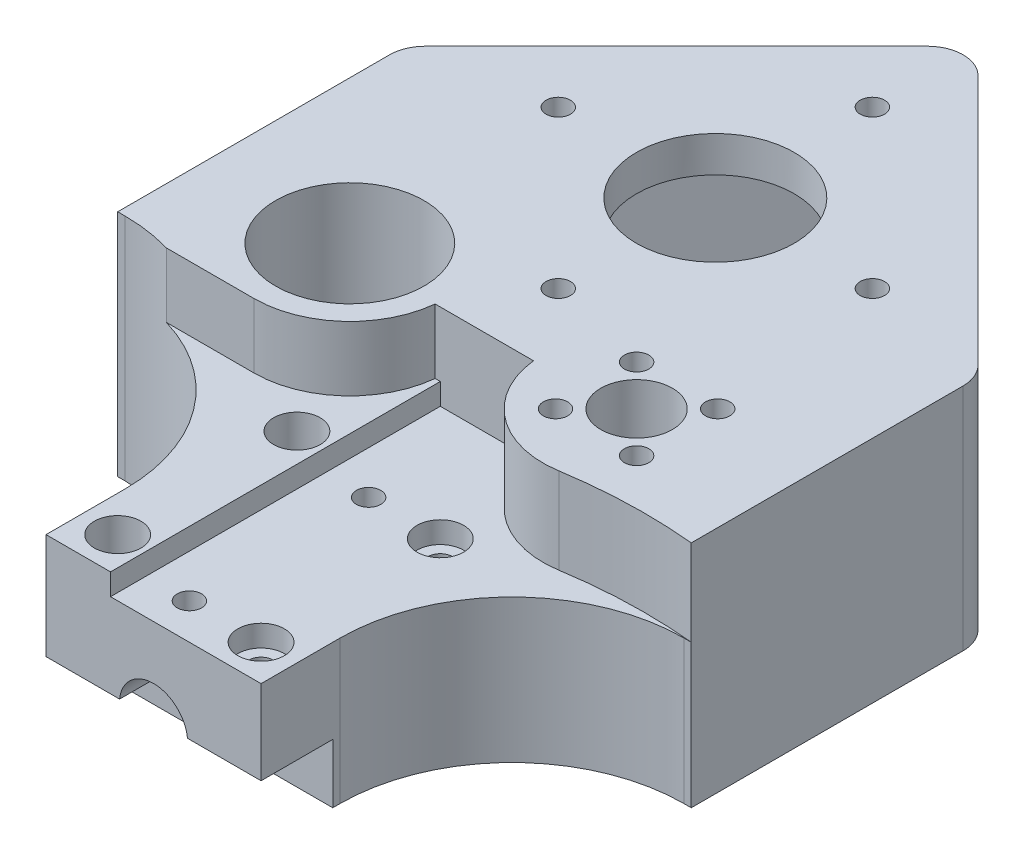
from build123d import *

# Parameters (mm, degrees)
BOSS_EXTRUDE1_DEPTH           = 32
SKETCH1_3_R                   = 5
CUT_EXTRUDE1_DEPTH            = 94.618841069
CUT_EXTRUDE2_START            = -32
SKETCH2_R                     = 11.05
CUT_EXTRUDE2_DEPTH            = 5.5
M3_CLEARANCE_HOLE1_D          = 3.4
MOTOR_START                   = -5
MOTOR_POCKET_DEPTH            = 89.618841069
SKETCH6_R                     = 11
PILOT_DEPTH                   = 94.618841069
M3_CLEARANCE_HOLE2_D          = 3.4
SKETCH10_R                    = 10.35
BEARING_BORE_DEPTH            = 94.618841069
CUT_EXTRUDE6_START            = -12
CUT_EXTRUDE6_DEPTH            = 12
CUT_EXTRUDE14_START           = 3
CUT_EXTRUDE14_DEPTH           = 10
FILLET7_R                     = 5
FILLET11_R                    = 5
M3_CLEARANCE_HOLE4_D          = 3.4
CUT_EXTRUDE13_DEPTH           = 91.10972771
CUT_EXTRUDE13_DEPTH_BACK      = 3
SKETCH28_R                    = 4.7625
CUT_EXTRUDE17_DEPTH           = 45
SKETCH29_W                    = 30
SKETCH29_H                    = 10
CUT_EXTRUDE18_DEPTH           = 8.2625
CBORE_FOR_M3_SHCS1_AT_2_COUNT = 2
CBORE_FOR_M3_SHCS1_AT_2_PITCH = 25
CBORE_FOR_M3_SHCS1_AT_3_COUNT = 2
CBORE_FOR_M3_SHCS1_AT_3_PITCH = 32.015621187
CBORE_FOR_M3_SHCS1_AT_4_COUNT = 2
CBORE_FOR_M3_SHCS1_AT_4_PITCH = 20
SKETCH32_R                    = 3.25
CUT_EXTRUDE19_DEPTH           = 91.224649642


with BuildPart() as part:
    # Sketch1 → Boss-Extrude1 (new body)
    with BuildSketch(Plane(origin=(0, 0, 0), x_dir=(1, 0, 0), z_dir=(0, 1, 0))):
        with BuildLine():
            Line((0, 36.638737867), (40, -3.361262133))
            Line((40, -3.361262133), (40, -43.361262133))
            Line((40, -43.361262133), (39, -43.361262133))
            ThreePointArc((39, -43.361262133), (22.029437252, -50.390699384), (15, -67.361262133))
            Line((15, -67.361262133), (15, -78.361262133))
            Line((15, -78.361262133), (-15, -78.361262133))
            Line((-15, -78.361262133), (-15, -67.361262133))
            ThreePointArc((-15, -67.361262133), (-22.029437252, -50.390699384), (-39, -43.361262133))
            Line((-39, -43.361262133), (-40, -43.361262133))
            Line((-40, -43.361262133), (-40, -3.361262133))
            Line((-40, -3.361262133), (0, 36.638737867))
        make_face()
    extrude(amount=BOSS_EXTRUDE1_DEPTH)

    # Sketch1<3> → Cut-Extrude1 (cut, through all)
    with BuildSketch(Plane(origin=(0, 0, 0), x_dir=(1, 0, 0), z_dir=(0, 1, 0))):
        with Locations(Location((20, -30.981883618, 0), (0, 0, 270))):
            Circle(SKETCH1_3_R)
    extrude(amount=CUT_EXTRUDE1_DEPTH, mode=Mode.SUBTRACT)

    # Sketch2 → Cut-Extrude2 (cut)
    with BuildSketch(Plane(origin=(0, 32, 0), x_dir=(1, 0, 0), z_dir=(0, 1, 0)).offset(CUT_EXTRUDE2_START)):
        with Locations(Location((20, -30.981883618, 0), (0, 0, 90))):
            Circle(SKETCH2_R)
    extrude(amount=CUT_EXTRUDE2_DEPTH, mode=Mode.SUBTRACT)

    # M3 Clearance Hole1 (through all)
    with Locations(Plane(origin=(0, 32, 0), x_dir=(-1, 0, 0), z_dir=(0, 1, 0))):
        with Locations((-25.656854249, 25.325029368), (-25.656854249, 36.638737867), (-14.343145751, 36.638737867), (-14.343145751, 25.325029368)):
            Hole(M3_CLEARANCE_HOLE1_D / 2)

    # Sketch5 → Motor Pocket (cut, through all)
    with BuildSketch(Plane(origin=(0, 32, 0), x_dir=(1, 0, 0), z_dir=(0, 1, 0)).offset(MOTOR_START)):
        Polygon((0, 29.839906166), (-29.839906166, 0), (0, -29.839906166), (29.839906166, 0), align=None)
    extrude(amount=-MOTOR_POCKET_DEPTH, mode=Mode.SUBTRACT)

    # Sketch6 → Pilot (cut, through all)
    with BuildSketch(Plane(origin=(0, 32, 0), x_dir=(1, 0, 0), z_dir=(0, 1, 0))):
        with Locations(Location((0, 0, 0), (0, 0, 270))):
            Circle(SKETCH6_R)
    extrude(amount=-PILOT_DEPTH, mode=Mode.SUBTRACT)

    # M3 Clearance Hole2 (through all)
    with Locations(Plane(origin=(0, 32, 0), x_dir=(-1, 0, 0), z_dir=(0, 1, 0))):
        with Locations((21.9075, 0), (0, -21.9075), (-21.9075, 0), (0, 21.9075)):
            Hole(M3_CLEARANCE_HOLE2_D / 2)

    # Sketch10 → Bearing Bore (cut, through all)
    with BuildSketch(Plane(origin=(0, 32, 0), x_dir=(1, 0, 0), z_dir=(0, 1, 0))):
        with Locations(Location((-20, -30.981883618, 0), (0, 0, 270))):
            Circle(SKETCH10_R)
    extrude(amount=-BEARING_BORE_DEPTH, mode=Mode.SUBTRACT)

    # Sketch11 → Cut-Extrude6 (cut)
    with BuildSketch(Plane(origin=(0, 32, 0), x_dir=(1, 0, 0), z_dir=(0, 1, 0)).offset(CUT_EXTRUDE6_START)):
        with BuildLine():
            Line((-6, -32.361262133), (7, -32.361262133))
            ThreePointArc((7, -32.361262133), (12.052230702, -41.361462043), (22.05853806, -43.891767666))
            ThreePointArc((22.05853806, -43.891767666), (31.012194637, -43.049066482), (40, -43.361262133))
            Line((40, -43.361262133), (39, -43.361262133))
            ThreePointArc((39, -43.361262133), (22.029437252, -50.390699384), (15, -67.361262133))
            Line((15, -67.361262133), (15, -78.361262133))
            Line((15, -78.361262133), (-6, -78.361262133))
            Line((-6, -78.361262133), (-6, -32.361262133))
        make_face()
    extrude(amount=CUT_EXTRUDE6_DEPTH, mode=Mode.SUBTRACT)

    # Sketch26 → Cut-Extrude14 (cut)
    with BuildSketch(Plane(origin=(0, 20, 0), x_dir=(1, 0, 0), z_dir=(0, 1, 0)).offset(CUT_EXTRUDE14_START)):
        with BuildLine():
            Line((-6, -32.361262133), (-6.721452831, -32.361262133))
            ThreePointArc((-6.721452831, -32.361262133), (-11.061101946, -40.897457307), (-20, -44.331883618))
            Line((-20, -44.331883618), (-32.243689971, -44.331883618))
            ThreePointArc((-32.243689971, -44.331883618), (-19.788656467, -52.976399268), (-15, -67.361262133))
            Line((-15, -67.361262133), (-15, -78.361262133))
            Line((-15, -78.361262133), (-6, -78.361262133))
            Line((-6, -78.361262133), (-6, -32.361262133))
        make_face()
    extrude(amount=CUT_EXTRUDE14_DEPTH, mode=Mode.SUBTRACT)

    # Fillet7
    fillet7_edges = [part.edges().sort_by_distance(p)[0] for p in [
        (0, 16, -36.638737867),
    ]]
    fillet(fillet7_edges, radius=FILLET7_R)

    # Fillet11
    fillet11_edges = [part.edges().sort_by_distance(p)[0] for p in [
        (-40, 16, 3.361262133),
        (40, 16, 3.361262133),
    ]]
    fillet(fillet11_edges, radius=FILLET11_R)

    # M3 Clearance Hole4 (through all)
    with Locations(Plane(origin=(0, 20, 0), x_dir=(-1, 0, 0), z_dir=(0, 1, 0))):
        with Locations((0, 48.361262133), (0, 73.361262133)):
            Hole(M3_CLEARANCE_HOLE4_D / 2)

    # Sketch24 → Cut-Extrude13 (cut, two sides: drawn at the far end of the back side and taken through both)
    with BuildSketch(Plane.XZ.offset(-12.525).offset(-CUT_EXTRUDE13_DEPTH_BACK)):
        Polygon((1.558845727, 45.661262133), (3.117691454, 48.361262133), (1.558845727, 51.061262133), (-1.558845727, 51.061262133), (-3.117691454, 48.361262133), (-1.558845727, 45.661262133), align=None)
        Polygon((1.558845727, 70.661262133), (3.117691454, 73.361262133), (1.558845727, 76.061262133), (-1.558845727, 76.061262133), (-3.117691454, 73.361262133), (-1.558845727, 70.661262133), align=None)
    extrude(amount=CUT_EXTRUDE13_DEPTH + CUT_EXTRUDE13_DEPTH_BACK, mode=Mode.SUBTRACT)

    # Sketch28 → Cut-Extrude17 (cut)
    with BuildSketch(Plane.XY.offset(78.361262133)):
        with Locations((0, 7.7625)):
            Circle(SKETCH28_R)
    extrude(amount=-CUT_EXTRUDE17_DEPTH, mode=Mode.SUBTRACT)

    # Sketch29 → Cut-Extrude18 (cut)
    with BuildSketch(Plane.XZ):
        with Locations((0, 73.361262133)):
            Rectangle(SKETCH29_W, SKETCH29_H)
        with Locations((0, 48.361262133)):
            Rectangle(SKETCH29_W, SKETCH29_H)
    extrude(amount=-CUT_EXTRUDE18_DEPTH, mode=Mode.SUBTRACT)

    # Sketch30 → CBORE for M3 SHCS1 (revolve, cut)
    with BuildSketch(Plane(origin=(10, 20, 73.361262133), x_dir=(0, 0, 1), z_dir=(1, 0, 0))):
        Polygon((0, 0), (0, 20), (1.7, 20), (1.7, 3), (3.25, 3), (3.25, 0), align=None)
    cbore_for_m3_shcs1 = revolve(axis=Axis((10, 26.35, 73.361262133), (0, -1, 0)), mode=Mode.SUBTRACT)

    # CBORE for M3 SHCS1 at 2: CBORE for M3 SHCS1 ×2
    with Locations(*[(0, 0, -i * CBORE_FOR_M3_SHCS1_AT_2_PITCH) for i in range(1, CBORE_FOR_M3_SHCS1_AT_2_COUNT)]):
        add(cbore_for_m3_shcs1, mode=Mode.SUBTRACT)

    # CBORE for M3 SHCS1 at 3: CBORE for M3 SHCS1 ×2
    with Locations(*[Vector(-0.624695047554424, 0, -0.7808688094430305) * (i * CBORE_FOR_M3_SHCS1_AT_3_PITCH) for i in range(1, CBORE_FOR_M3_SHCS1_AT_3_COUNT)]):
        add(cbore_for_m3_shcs1, mode=Mode.SUBTRACT)

    # CBORE for M3 SHCS1 at 4: CBORE for M3 SHCS1 ×2
    with Locations(*[(-i * CBORE_FOR_M3_SHCS1_AT_4_PITCH, 0, 0) for i in range(1, CBORE_FOR_M3_SHCS1_AT_4_COUNT)]):
        add(cbore_for_m3_shcs1, mode=Mode.SUBTRACT)

    # Sketch32 → Cut-Extrude19 (cut, through all)
    with BuildSketch(Plane(origin=(0, 20, 0), x_dir=(1, 0, 0), z_dir=(0, 1, 0))):
        with Locations(Location((-10, -73.361262133, 0), (0, 0, 270))):
            Circle(SKETCH32_R)
        with Locations(Location((-10, -48.361262133, 0), (0, 0, 270))):
            Circle(SKETCH32_R)
    extrude(amount=CUT_EXTRUDE19_DEPTH, mode=Mode.SUBTRACT)


solid = part.part
